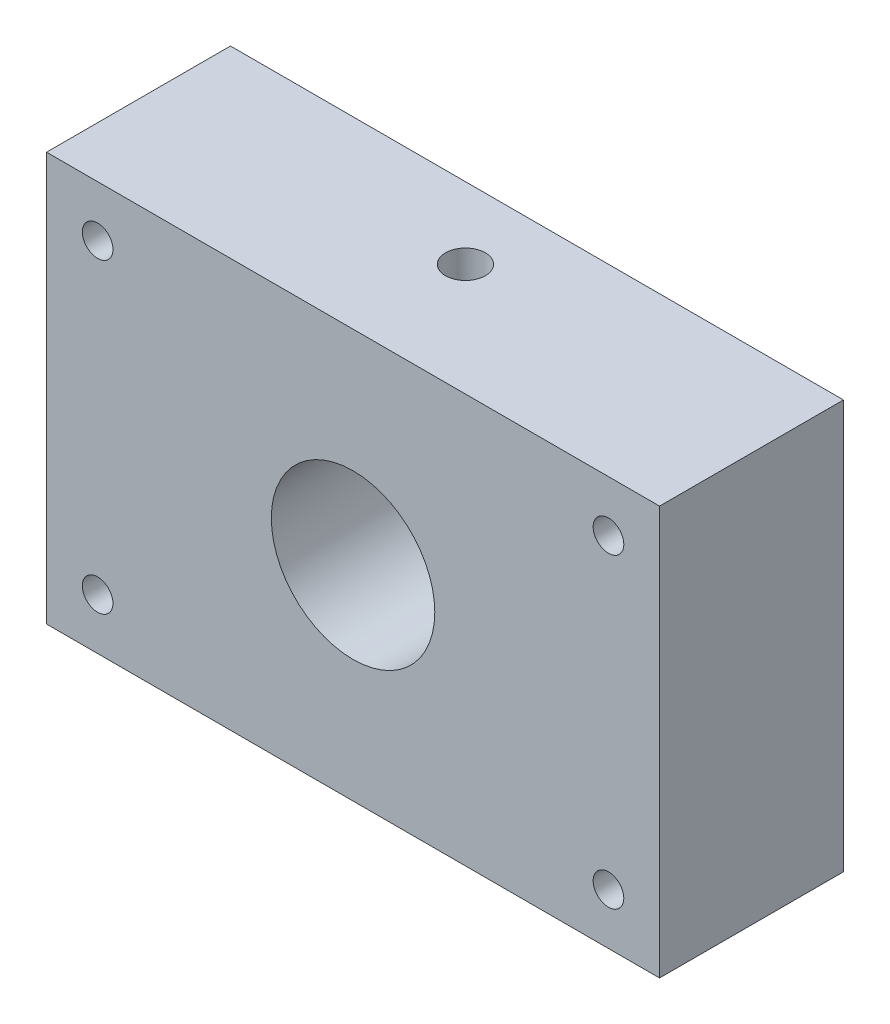
from build123d import *

# Parameters (mm, degrees)
IZIM1_W                     = 60
IZIM1_H                     = 40
IZIM1_R                     = 1.5
IZIM1_R_2                   = 8
Y_KSEKLIK_EKSTR_ZYON1_DEPTH = 18
IZIM2_R                     = 1.95
KES_EKSTR_ZYON1_DEPTH       = 28


with BuildPart() as part:
    # Çizim1 → Yükseklik-Ekstrüzyon1 (new body)
    with BuildSketch(Plane.XY):
        Rectangle(IZIM1_W, IZIM1_H)
        with Locations((-25, 15)):
            Circle(IZIM1_R, mode=Mode.SUBTRACT)
        Circle(IZIM1_R_2, mode=Mode.SUBTRACT)
        with Locations((25, 15)):
            Circle(IZIM1_R, mode=Mode.SUBTRACT)
        with Locations((25, -15)):
            Circle(IZIM1_R, mode=Mode.SUBTRACT)
        with Locations((-25, -15)):
            Circle(IZIM1_R, mode=Mode.SUBTRACT)
    extrude(amount=Y_KSEKLIK_EKSTR_ZYON1_DEPTH)

    # Çizim2 → Kes-Ekstrüzyon1 (cut)
    with BuildSketch(Plane(origin=(0, 20, 0), x_dir=(1, 0, 0), z_dir=(0, 1, 0))):
        with Locations(Location((0, -7, 0), (0, 0, 270))):
            Circle(IZIM2_R)
    extrude(amount=-KES_EKSTR_ZYON1_DEPTH, mode=Mode.SUBTRACT)


solid = part.part
